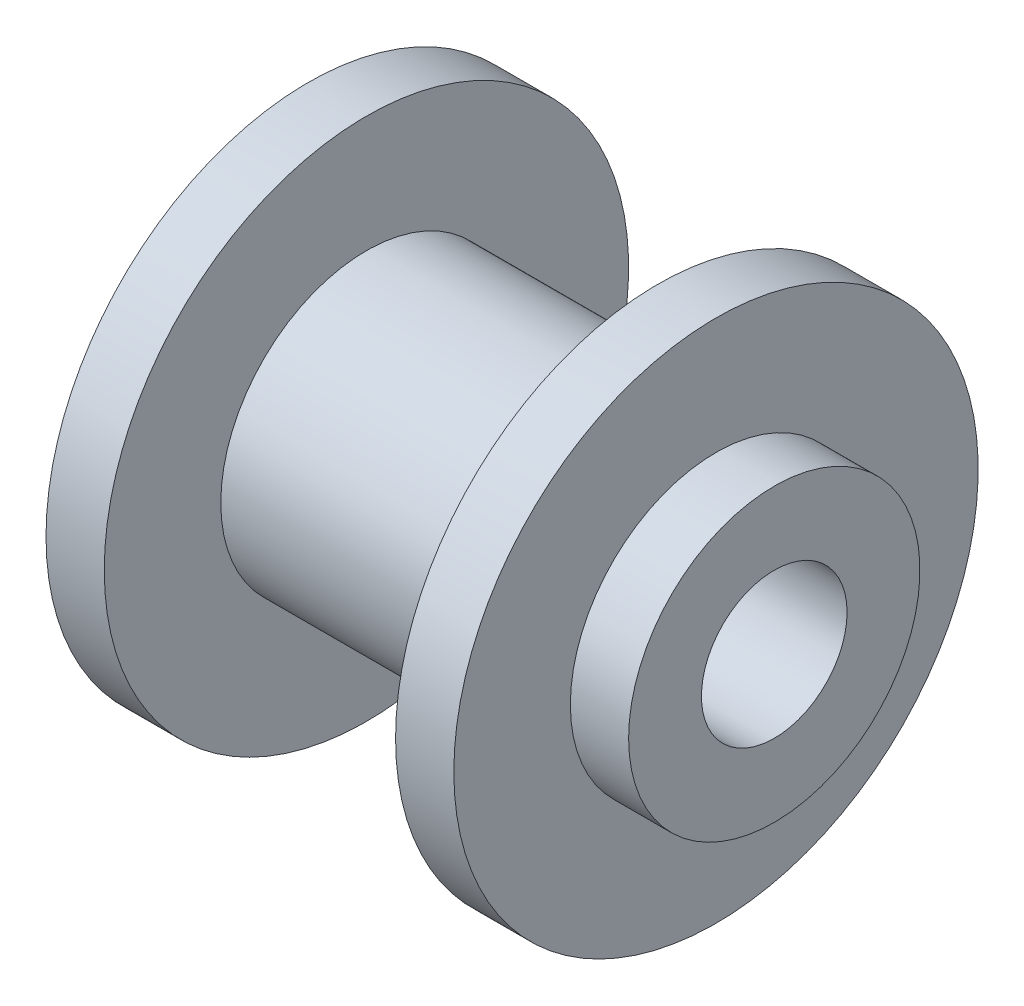
from build123d import *

# Parameters (mm, degrees)
SKETCH2_R          = 2.5
CUT_EXTRUDE1_DEPTH = 23.045407685


with BuildPart() as part:
    # Sketch1 → Revolve1 (revolve)
    with BuildSketch(Plane.XY, mode=Mode.PRIVATE) as revolve1_sk:
        Polygon((0, 0), (0, 5), (2, 5), (2, 9), (4, 9), (4, 5), (14, 5), (14, 9), (16, 9), (16, 5), (18, 5), (18, 0), align=None)
    revolve(revolve1_sk.sketch.rotate(Axis((0, 0, 0), (1, 0, 0)), 90), axis=Axis((0, 0, 0), (1, 0, 0)))

    # Sketch2 → Cut-Extrude1 (cut, through all)
    with BuildSketch(Plane(origin=(18, 0, 0), x_dir=(0, 0, -1), z_dir=(1, 0, 0))):
        Circle(SKETCH2_R)
    extrude(amount=-CUT_EXTRUDE1_DEPTH, mode=Mode.SUBTRACT)


solid = part.part
